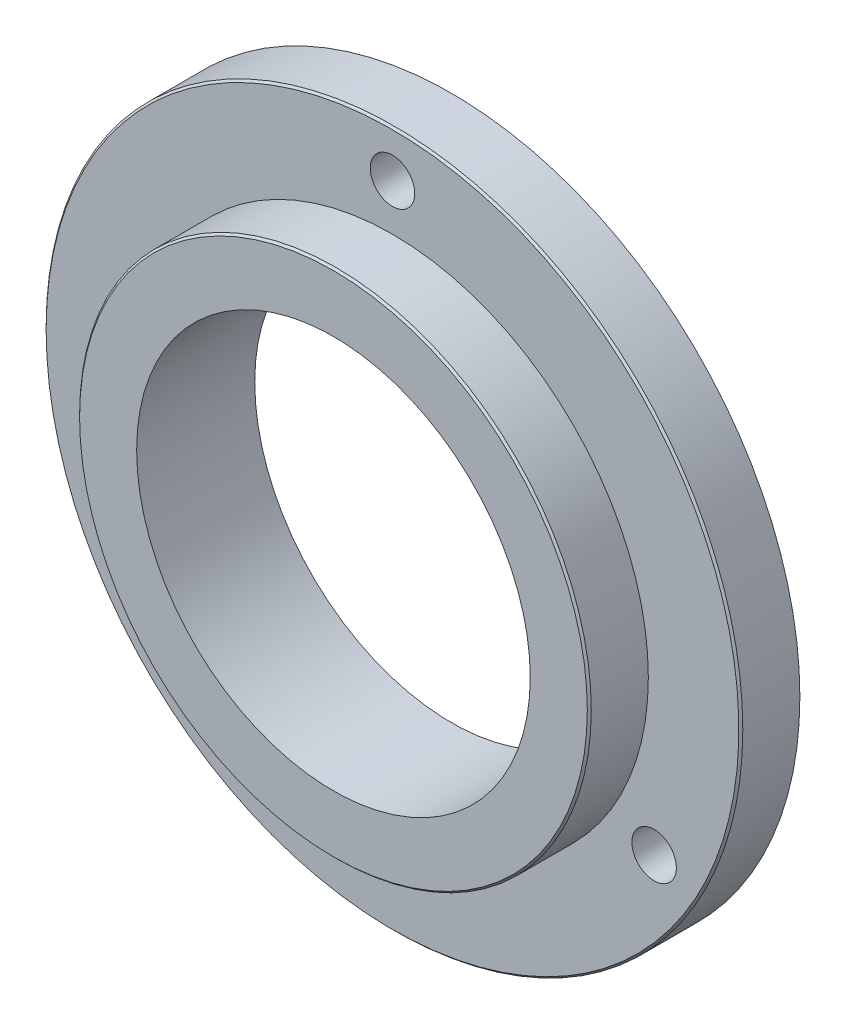
from build123d import *
from build123d.topology import SkipClean

# Parameters (mm, degrees)
ESQUISSE10_R          = 13
ESQUISSE10_R_2        = 10
BOSS_EXTRU_2_DEPTH    = 3
BOSS_EXTRU_3_START    = 3
ESQUISSE11_R          = 17.7
ESQUISSE11_R_2        = 10
BOSS_EXTRU_3_DEPTH    = 3
F_4_40_TAPPED_HOLE1_D = 2.2606
CIRPATTERN1_COUNT     = 3
CHAMFER1_SIZE         = 0.1
CHAMFER2_SIZE         = 0.1


with BuildPart() as part:
    # Esquisse10 → Boss.-Extru.2 (new body)
    with BuildSketch(Plane.XY):
        Circle(ESQUISSE10_R)
        Circle(ESQUISSE10_R_2, mode=Mode.SUBTRACT)
    extrude(amount=BOSS_EXTRU_2_DEPTH)

    # Esquisse11 → Boss.-Extru.3 (add)
    with SkipClean():  # the faces are left unmerged after this step: merging them gives an invalid solid
        with BuildSketch(Plane(origin=(0, 0, 0), x_dir=(-1, 0, 0), z_dir=(0, 0, -1)).offset(BOSS_EXTRU_3_START)):
            Circle(ESQUISSE11_R)
            Circle(ESQUISSE11_R_2, mode=Mode.SUBTRACT)
        extrude(amount=-BOSS_EXTRU_3_DEPTH)

    # #4-40 Tapped Hole1 (through all)
    with Locations(Plane.XY):
        with Locations((0, 15.35)):
            f_4_40_tapped_hole1 = Hole(F_4_40_TAPPED_HOLE1_D / 2)

    # CirPattern1: #4-40 Tapped Hole1 ×3 about axis
    with SkipClean():  # the faces are left unmerged after this step: merging them gives an invalid solid
        cirpattern1_axis = Axis((0, 0, 0), (0, 0, 1))
        for i in range(1, CIRPATTERN1_COUNT):
            add(f_4_40_tapped_hole1.rotate(cirpattern1_axis, i * 360 / CIRPATTERN1_COUNT), mode=Mode.SUBTRACT)

    # Chamfer1
    chamfer1_edges = [part.edges().sort_by_distance(p)[0] for p in [
        (17.7, 0, 0),
    ]]
    chamfer(chamfer1_edges, length=CHAMFER1_SIZE)

    # Chamfer2
    chamfer2_edges = [part.edges().sort_by_distance(p)[0] for p in [
        (-13, 0, 3),
    ]]
    chamfer(chamfer2_edges, length=CHAMFER2_SIZE)


solid = part.part
